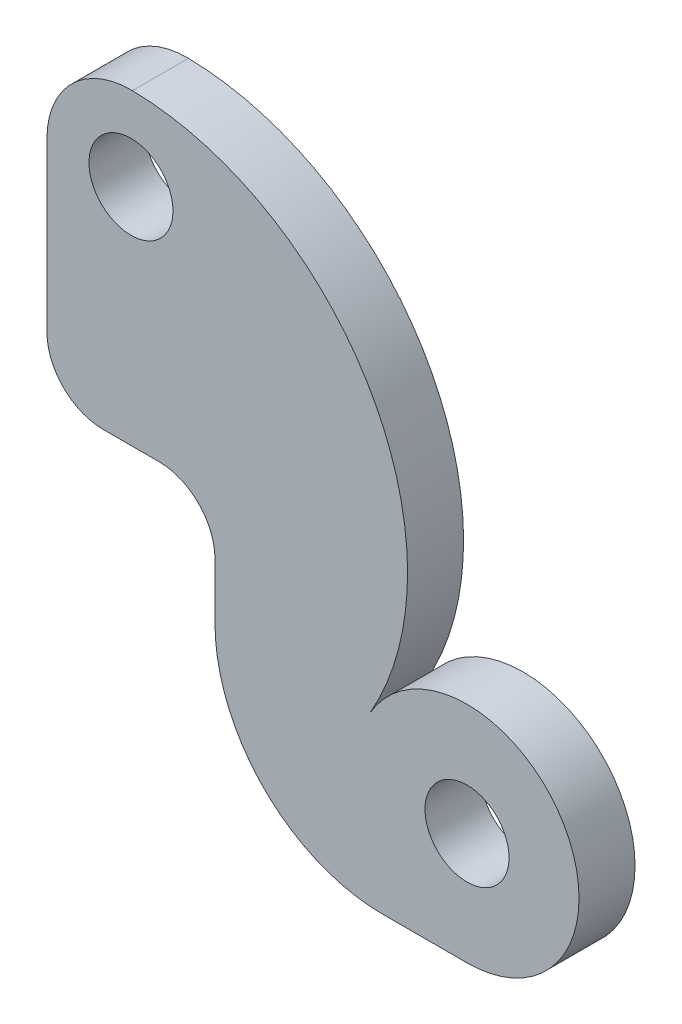
from build123d import *

# Parameters (mm, degrees)
SKETCH1_R           = 7.5
BOSS_EXTRUDE1_DEPTH = 5


with BuildPart() as part:
    # Sketch1 → Boss-Extrude1 (new, symmetric)
    with BuildSketch(Plane.XY):
        with BuildLine():
            Line((-30, 70), (-30, 40))
            ThreePointArc((-30, 40), (-27.071067812, 32.928932188), (-20, 30))
            Line((-20, 30), (-10, 30))
            ThreePointArc((-10, 30), (-2.928932188, 27.071067812), (0, 20))
            Line((0, 20), (0, 10))
            ThreePointArc((0, 10), (8.786796564, -11.213203436), (30, -20))
            Line((30, -20), (45, -20))
            ThreePointArc((45, -20), (62.320959018, 9.999218904), (27.680393915, 10.001562131))
            ThreePointArc((27.680393915, 10.001562131), (27.903012663, 59.619840851), (-14.734876587, 84.997656803))
            ThreePointArc((-14.734876587, 84.997656803), (-25.512448545, 80.699926429), (-30, 70))
        make_face()
        with Locations((45, 0)):
            Circle(SKETCH1_R, mode=Mode.SUBTRACT)
        with Locations((-15, 70)):
            Circle(SKETCH1_R, mode=Mode.SUBTRACT)
    extrude(amount=BOSS_EXTRUDE1_DEPTH, both=True)


solid = part.part
